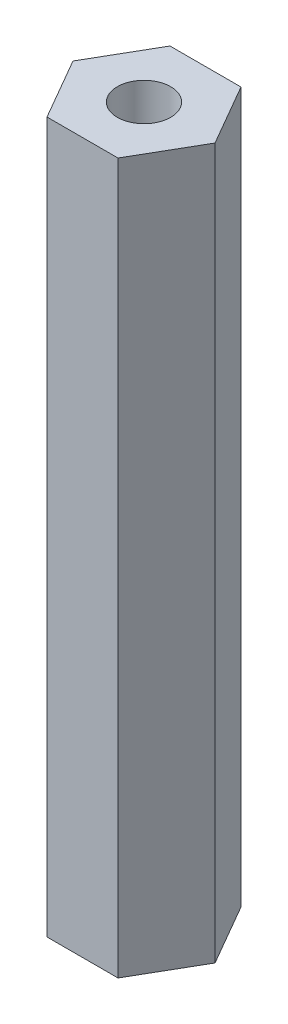
from build123d import *

# Parameters (mm, degrees)
BOSS_EXTRUDE1_DEPTH = 40
SKETCH2_R           = 1.5
CUT_EXTRUDE1_DEPTH  = 40


with BuildPart() as part:
    # Sketch1 → Boss-Extrude1 (new body)
    with BuildSketch(Plane(origin=(0, 0, 0), x_dir=(1, 0, 0), z_dir=(0, 1, 0))):
        Polygon((-4, 0), (-2, -3.464101615), (2, -3.464101615), (4, 0), (2, 3.464101615), (-2, 3.464101615), align=None)
    extrude(amount=BOSS_EXTRUDE1_DEPTH)

    # Sketch2 → Cut-Extrude1 (cut)
    with BuildSketch(Plane(origin=(0, 40, 0), x_dir=(1, 0, 0), z_dir=(0, 1, 0))):
        with Locations(Location((0, 0, 0), (0, 0, 270))):
            Circle(SKETCH2_R)
    extrude(amount=-CUT_EXTRUDE1_DEPTH, mode=Mode.SUBTRACT)


solid = part.part
